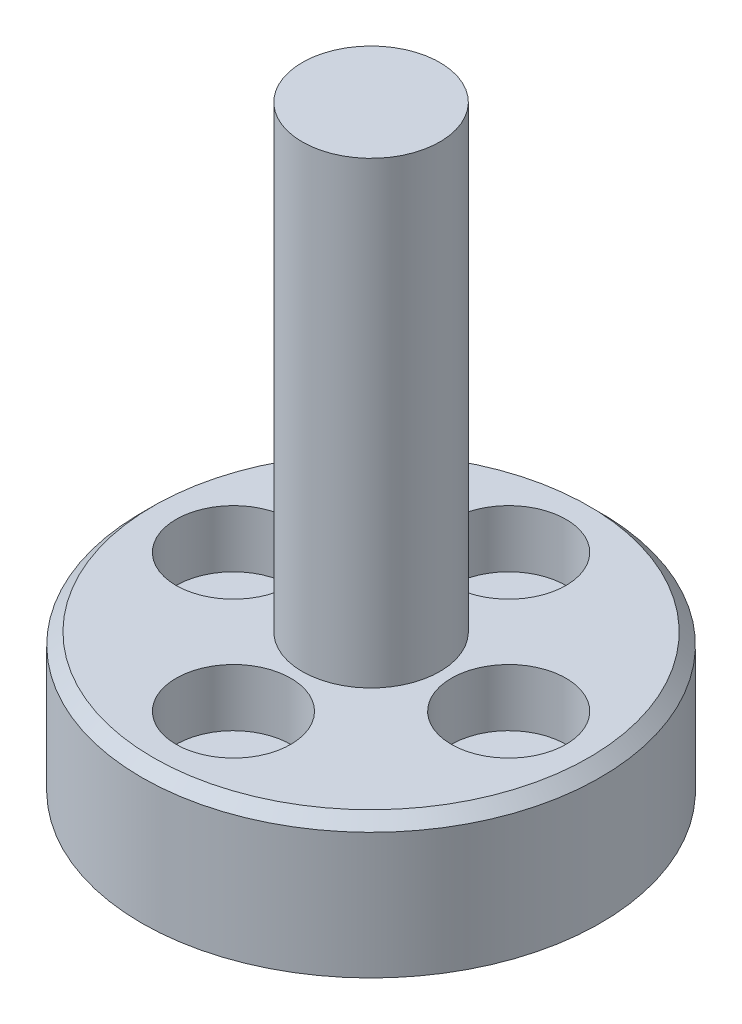
from build123d import *

# Parameters (mm, degrees)
SKETCH_2_R          = 1
CUT_EXTRUDE_1_DEPTH = 10
SKETCH_3_R          = 2.5
CUT_EXTRUDE_2_DEPTH = 2.5


with BuildPart() as part:
    # 草图1 → 旋转1 (revolve)
    with BuildSketch(Plane.XY, mode=Mode.PRIVATE) as revolve_1_sk:
        Polygon((0, 26), (3, 26), (3, 6), (9.5, 6), (10, 5.5), (10, 0), (3, 0), (3, 3), (0, 3), align=None)
    revolve(revolve_1_sk.sketch.rotate(Axis((0, 9.947317903, 0), (0, -1, 0)), 90), axis=Axis((0, 9.947317903, 0), (0, -1, 0)))

    # 草图2 → 切除-拉伸1 (cut)
    with BuildSketch(Plane(origin=(0, 6, 0), x_dir=(1, 0, 0), z_dir=(0, 1, 0))):
        with Locations(Location((0, 6, 0), (0, 0, 270))):
            Circle(SKETCH_2_R)
        with Locations(Location((6, 0, 0), (0, 0, 270))):
            Circle(SKETCH_2_R)
        with Locations(Location((0, -6, 0), (0, 0, 270))):
            Circle(SKETCH_2_R)
        with Locations(Location((-6, 0, 0), (0, 0, 270))):
            Circle(SKETCH_2_R)
    extrude(amount=-CUT_EXTRUDE_1_DEPTH, mode=Mode.SUBTRACT)

    # 草图3 → 切除-拉伸2 (cut)
    with BuildSketch(Plane(origin=(0, 6, 0), x_dir=(1, 0, 0), z_dir=(0, 1, 0))):
        with Locations(Location((0, 6, 0), (0, 0, 270))):
            Circle(SKETCH_3_R)
        with Locations(Location((6, 0, 0), (0, 0, 270))):
            Circle(SKETCH_3_R)
        with Locations(Location((0, -6, 0), (0, 0, 270))):
            Circle(SKETCH_3_R)
        with Locations(Location((-6, 0, 0), (0, 0, 270))):
            Circle(SKETCH_3_R)
    extrude(amount=-CUT_EXTRUDE_2_DEPTH, mode=Mode.SUBTRACT)


solid = part.part
